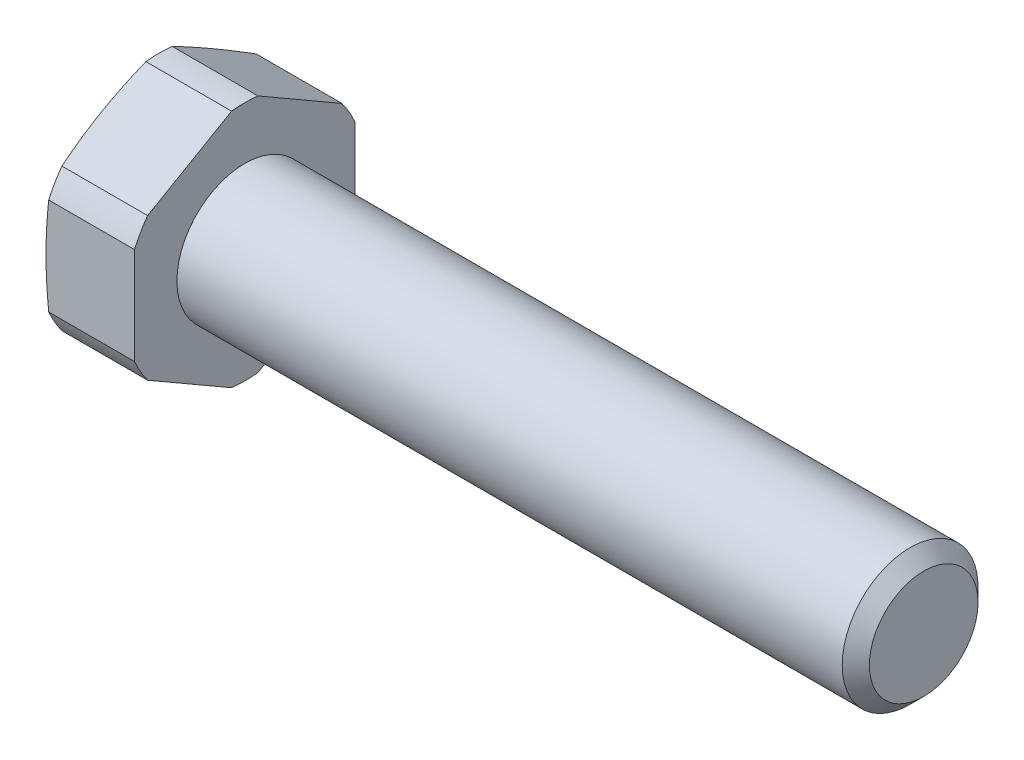
from build123d import *

# Parameters (mm, degrees)
SKETCH_2_OUTSIDE_W  = 26.11
SKETCH_2_OUTSIDE_H  = 26.11
CUT_EXTRUDE_1_DEPTH = 45.3


with BuildPart() as part:
    # Эскиз1 → Повернуть1 (revolve)
    with BuildSketch(Plane.XY, mode=Mode.PRIVATE) as revolve_1_sk:
        Polygon((-5.3, 0), (-5.3, 6.175), (-5.052146997, 7.1), (0, 7.1), (0, 4), (39.2, 4), (40, 3.2), (40, 0), align=None)
    revolve(revolve_1_sk.sketch.rotate(Axis((-1000, 0, 0), (1, 0, 0)), 90), axis=Axis((-1000, 0, 0), (1, 0, 0)))

    # Эскиз2 outside → Вырез-Вытянуть1 (cut)
    with BuildSketch(Plane.ZY.offset(5.3)):
        Rectangle(SKETCH_2_OUTSIDE_W, SKETCH_2_OUTSIDE_H)
        Polygon((0, 7.505553499), (-6.5, 3.75277675), (-6.5, -3.75277675), (0, -7.505553499), (6.5, -3.75277675), (6.5, 3.75277675), align=None, mode=Mode.SUBTRACT)
    extrude(amount=-CUT_EXTRUDE_1_DEPTH, mode=Mode.SUBTRACT)


solid = part.part
